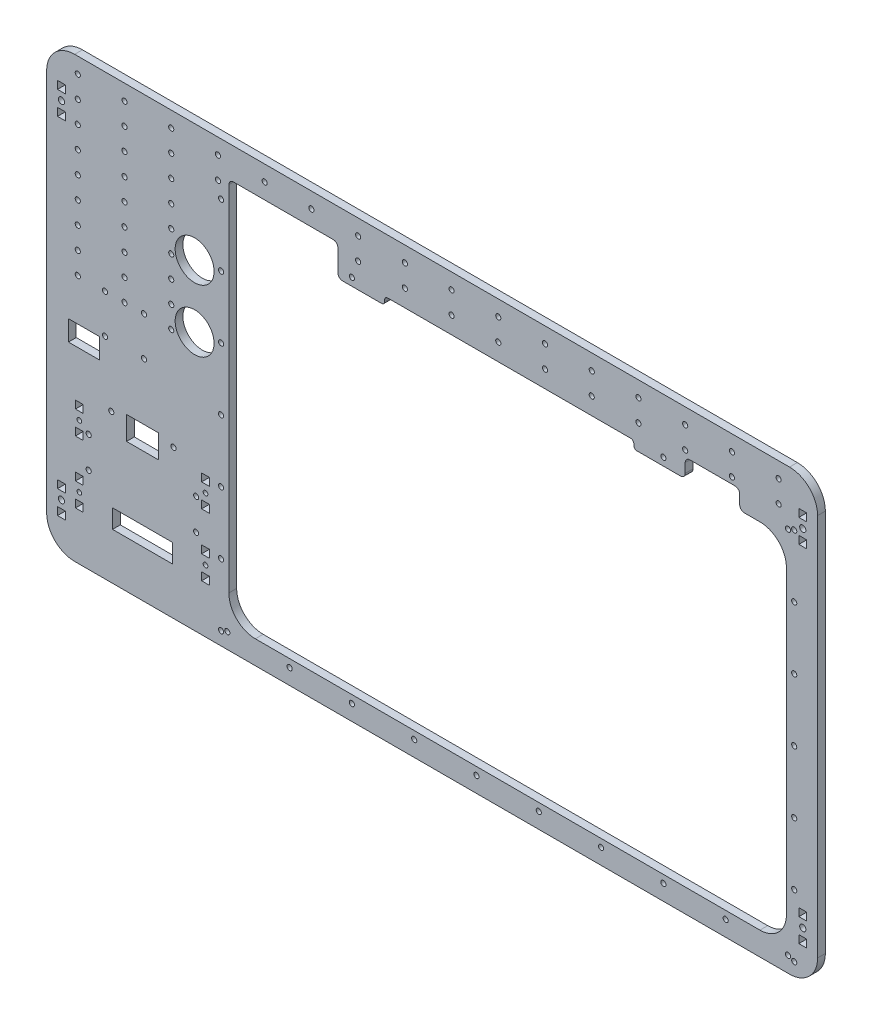
from build123d import *

# Parameters (mm, degrees)
ESQUISSE1_W        = 495
ESQUISSE1_H        = 282
ESQUISSE1_W_2      = 5
ESQUISSE1_H_2      = 5
ESQUISSE1_R        = 2
ESQUISSE1_R_2      = 1.65
ESQUISSE1_R_3      = 1.5
ESQUISSE1_W_3      = 38.4
ESQUISSE1_H_3      = 12
ESQUISSE1_W_4      = 20.4
ESQUISSE1_H_4      = 15
ESQUISSE1_W_5      = 19.8
ESQUISSE1_H_5      = 13
ESQUISSE1_R_4      = 12.5
BOSS_EXTRU_1_DEPTH = 5
CONG_1_R           = 18
CONG_2_R           = 17
CONG_3_R           = 3
CONG_4_R           = 2


with BuildPart() as part:
    # Esquisse1 → Boss.-Extru.1 (new body)
    with BuildSketch(Plane.XY):
        with Locations((-247.5, 141)):
            Rectangle(ESQUISSE1_W, ESQUISSE1_H)
        with Locations((-485.5, 22.5)):
            Rectangle(ESQUISSE1_W_2, ESQUISSE1_H_2, mode=Mode.SUBTRACT)
        with Locations((-485.5, 30)):
            Circle(ESQUISSE1_R, mode=Mode.SUBTRACT)
        with Locations((-474, 32.5)):
            Rectangle(ESQUISSE1_W_2, ESQUISSE1_H_2, mode=Mode.SUBTRACT)
        with Locations((-383, 8.5)):
            Circle(ESQUISSE1_R_2, mode=Mode.SUBTRACT)
        with Locations((-379, 10)):
            Circle(ESQUISSE1_R_2, mode=Mode.SUBTRACT)
        with Locations((-393, 32.5)):
            Rectangle(ESQUISSE1_W_2, ESQUISSE1_H_2, mode=Mode.SUBTRACT)
        with Locations((-485.5, 37.5)):
            Rectangle(ESQUISSE1_W_2, ESQUISSE1_H_2, mode=Mode.SUBTRACT)
        with Locations((-474, 40)):
            Circle(ESQUISSE1_R_3, mode=Mode.SUBTRACT)
        with Locations((-474, 47.5)):
            Rectangle(ESQUISSE1_W_2, ESQUISSE1_H_2, mode=Mode.SUBTRACT)
        with Locations((-433.5, 36)):
            Rectangle(ESQUISSE1_W_3, ESQUISSE1_H_3, mode=Mode.SUBTRACT)
        with Locations((-468, 55.2)):
            Circle(ESQUISSE1_R_2, mode=Mode.SUBTRACT)
        with Locations((-393, 40)):
            Circle(ESQUISSE1_R_3, mode=Mode.SUBTRACT)
        with Locations((-393, 47.5)):
            Rectangle(ESQUISSE1_W_2, ESQUISSE1_H_2, mode=Mode.SUBTRACT)
        with Locations((-383, 48.5)):
            Circle(ESQUISSE1_R_2, mode=Mode.SUBTRACT)
        with Locations((-399, 55.2)):
            Circle(ESQUISSE1_R_2, mode=Mode.SUBTRACT)
        with Locations((-339, 10)):
            Circle(ESQUISSE1_R_2, mode=Mode.SUBTRACT)
        with Locations((-299, 10)):
            Circle(ESQUISSE1_R_2, mode=Mode.SUBTRACT)
        with Locations((-259, 10)):
            Circle(ESQUISSE1_R_2, mode=Mode.SUBTRACT)
        with Locations((-474, 72.5)):
            Rectangle(ESQUISSE1_W_2, ESQUISSE1_H_2, mode=Mode.SUBTRACT)
        with Locations((-468, 75.2)):
            Circle(ESQUISSE1_R_2, mode=Mode.SUBTRACT)
        with Locations((-474, 80)):
            Circle(ESQUISSE1_R_3, mode=Mode.SUBTRACT)
        with Locations((-474, 87.5)):
            Rectangle(ESQUISSE1_W_2, ESQUISSE1_H_2, mode=Mode.SUBTRACT)
        with Locations((-453.5, 95.2)):
            Circle(ESQUISSE1_R_2, mode=Mode.SUBTRACT)
        with Locations((-433.5, 90.9)):
            Rectangle(ESQUISSE1_W_4, ESQUISSE1_H_4, mode=Mode.SUBTRACT)
        with Locations((-393, 72.5)):
            Rectangle(ESQUISSE1_W_2, ESQUISSE1_H_2, mode=Mode.SUBTRACT)
        with Locations((-399, 75.2)):
            Circle(ESQUISSE1_R_2, mode=Mode.SUBTRACT)
        with Locations((-393, 80)):
            Circle(ESQUISSE1_R_3, mode=Mode.SUBTRACT)
        with Locations((-393, 87.5)):
            Rectangle(ESQUISSE1_W_2, ESQUISSE1_H_2, mode=Mode.SUBTRACT)
        with Locations((-413.5, 95.2)):
            Circle(ESQUISSE1_R_2, mode=Mode.SUBTRACT)
        with Locations((-383, 88.5)):
            Circle(ESQUISSE1_R_2, mode=Mode.SUBTRACT)
        with Locations((-471.1, 126.5)):
            Rectangle(ESQUISSE1_W_5, ESQUISSE1_H_5, mode=Mode.SUBTRACT)
        with Locations((-457.5, 135)):
            Circle(ESQUISSE1_R_2, mode=Mode.SUBTRACT)
        with Locations((-432.5, 135)):
            Circle(ESQUISSE1_R_2, mode=Mode.SUBTRACT)
        with Locations((-383, 128.5)):
            Circle(ESQUISSE1_R_2, mode=Mode.SUBTRACT)
        with Locations((-219, 10)):
            Circle(ESQUISSE1_R_2, mode=Mode.SUBTRACT)
        with Locations((-179, 10)):
            Circle(ESQUISSE1_R_2, mode=Mode.SUBTRACT)
        with Locations((-139, 10)):
            Circle(ESQUISSE1_R_2, mode=Mode.SUBTRACT)
        with Locations((-99, 10)):
            Circle(ESQUISSE1_R_2, mode=Mode.SUBTRACT)
        with Locations((-59, 10)):
            Circle(ESQUISSE1_R_2, mode=Mode.SUBTRACT)
        with Locations((-15, 8.5)):
            Circle(ESQUISSE1_R_2, mode=Mode.SUBTRACT)
        with Locations((-19, 10)):
            Circle(ESQUISSE1_R_2, mode=Mode.SUBTRACT)
        with Locations((-9.5, 22.5)):
            Rectangle(ESQUISSE1_W_2, ESQUISSE1_H_2, mode=Mode.SUBTRACT)
        with Locations((-9.5, 30)):
            Circle(ESQUISSE1_R, mode=Mode.SUBTRACT)
        with Locations((-9.5, 37.5)):
            Rectangle(ESQUISSE1_W_2, ESQUISSE1_H_2, mode=Mode.SUBTRACT)
        with Locations((-15, 48.5)):
            Circle(ESQUISSE1_R_2, mode=Mode.SUBTRACT)
        Polygon((-378, 15), (-378, 242), (-378, 262), (-308, 262), (-308, 242), (-278, 242), (-278, 247), (-118, 247), (-118, 242), (-85, 242), (-85, 254), (-50, 254), (-50, 242), (-20, 242), (-20, 15), align=None, mode=Mode.SUBTRACT)
        with Locations((-15, 88.5)):
            Circle(ESQUISSE1_R_2, mode=Mode.SUBTRACT)
        with Locations((-15, 128.5)):
            Circle(ESQUISSE1_R_2, mode=Mode.SUBTRACT)
        with Locations((-475, 160)):
            Circle(ESQUISSE1_R_2, mode=Mode.SUBTRACT)
        with Locations((-475, 174)):
            Circle(ESQUISSE1_R_2, mode=Mode.SUBTRACT)
        with Locations((-457.5, 160)):
            Circle(ESQUISSE1_R_2, mode=Mode.SUBTRACT)
        with Locations((-445, 160)):
            Circle(ESQUISSE1_R_2, mode=Mode.SUBTRACT)
        with Locations((-445, 174)):
            Circle(ESQUISSE1_R_2, mode=Mode.SUBTRACT)
        with Locations((-432.5, 160)):
            Circle(ESQUISSE1_R_2, mode=Mode.SUBTRACT)
        with Locations((-415, 160)):
            Circle(ESQUISSE1_R_2, mode=Mode.SUBTRACT)
        with Locations((-415, 174)):
            Circle(ESQUISSE1_R_2, mode=Mode.SUBTRACT)
        with Locations((-400, 166)):
            Circle(ESQUISSE1_R_4, mode=Mode.SUBTRACT)
        with Locations((-383, 168.5)):
            Circle(ESQUISSE1_R_2, mode=Mode.SUBTRACT)
        with Locations((-475, 188)):
            Circle(ESQUISSE1_R_2, mode=Mode.SUBTRACT)
        with Locations((-445, 188)):
            Circle(ESQUISSE1_R_2, mode=Mode.SUBTRACT)
        with Locations((-475, 202)):
            Circle(ESQUISSE1_R_2, mode=Mode.SUBTRACT)
        with Locations((-445, 202)):
            Circle(ESQUISSE1_R_2, mode=Mode.SUBTRACT)
        with Locations((-415, 188)):
            Circle(ESQUISSE1_R_2, mode=Mode.SUBTRACT)
        with Locations((-415, 202)):
            Circle(ESQUISSE1_R_2, mode=Mode.SUBTRACT)
        with Locations((-400, 206)):
            Circle(ESQUISSE1_R_4, mode=Mode.SUBTRACT)
        with Locations((-383, 208.5)):
            Circle(ESQUISSE1_R_2, mode=Mode.SUBTRACT)
        with Locations((-475, 216)):
            Circle(ESQUISSE1_R_2, mode=Mode.SUBTRACT)
        with Locations((-445, 216)):
            Circle(ESQUISSE1_R_2, mode=Mode.SUBTRACT)
        with Locations((-475, 230)):
            Circle(ESQUISSE1_R_2, mode=Mode.SUBTRACT)
        with Locations((-485.5, 244.5)):
            Rectangle(ESQUISSE1_W_2, ESQUISSE1_H_2, mode=Mode.SUBTRACT)
        with Locations((-475, 244)):
            Circle(ESQUISSE1_R_2, mode=Mode.SUBTRACT)
        with Locations((-445, 230)):
            Circle(ESQUISSE1_R_2, mode=Mode.SUBTRACT)
        with Locations((-445, 244)):
            Circle(ESQUISSE1_R_2, mode=Mode.SUBTRACT)
        with Locations((-415, 216)):
            Circle(ESQUISSE1_R_2, mode=Mode.SUBTRACT)
        with Locations((-415, 230)):
            Circle(ESQUISSE1_R_2, mode=Mode.SUBTRACT)
        with Locations((-415, 244)):
            Circle(ESQUISSE1_R_2, mode=Mode.SUBTRACT)
        with Locations((-485.5, 252)):
            Circle(ESQUISSE1_R, mode=Mode.SUBTRACT)
        with Locations((-485.5, 259.5)):
            Rectangle(ESQUISSE1_W_2, ESQUISSE1_H_2, mode=Mode.SUBTRACT)
        with Locations((-475, 258)):
            Circle(ESQUISSE1_R_2, mode=Mode.SUBTRACT)
        with Locations((-445, 258)):
            Circle(ESQUISSE1_R_2, mode=Mode.SUBTRACT)
        with Locations((-475, 272)):
            Circle(ESQUISSE1_R_2, mode=Mode.SUBTRACT)
        with Locations((-445, 272)):
            Circle(ESQUISSE1_R_2, mode=Mode.SUBTRACT)
        with Locations((-415, 258)):
            Circle(ESQUISSE1_R_2, mode=Mode.SUBTRACT)
        with Locations((-383, 248.5)):
            Circle(ESQUISSE1_R_2, mode=Mode.SUBTRACT)
        with Locations((-385, 258)):
            Circle(ESQUISSE1_R_2, mode=Mode.SUBTRACT)
        with Locations((-415, 272)):
            Circle(ESQUISSE1_R_2, mode=Mode.SUBTRACT)
        with Locations((-385, 272)):
            Circle(ESQUISSE1_R_2, mode=Mode.SUBTRACT)
        with Locations((-355, 272)):
            Circle(ESQUISSE1_R_2, mode=Mode.SUBTRACT)
        with Locations((-325, 272)):
            Circle(ESQUISSE1_R_2, mode=Mode.SUBTRACT)
        with Locations((-299, 247)):
            Circle(ESQUISSE1_R_2, mode=Mode.SUBTRACT)
        with Locations((-295, 258)):
            Circle(ESQUISSE1_R_2, mode=Mode.SUBTRACT)
        with Locations((-265, 258)):
            Circle(ESQUISSE1_R_2, mode=Mode.SUBTRACT)
        with Locations((-295, 272)):
            Circle(ESQUISSE1_R_2, mode=Mode.SUBTRACT)
        with Locations((-265, 272)):
            Circle(ESQUISSE1_R_2, mode=Mode.SUBTRACT)
        with Locations((-15, 168.5)):
            Circle(ESQUISSE1_R_2, mode=Mode.SUBTRACT)
        with Locations((-15, 208.5)):
            Circle(ESQUISSE1_R_2, mode=Mode.SUBTRACT)
        with Locations((-235, 258)):
            Circle(ESQUISSE1_R_2, mode=Mode.SUBTRACT)
        with Locations((-205, 258)):
            Circle(ESQUISSE1_R_2, mode=Mode.SUBTRACT)
        with Locations((-235, 272)):
            Circle(ESQUISSE1_R_2, mode=Mode.SUBTRACT)
        with Locations((-205, 272)):
            Circle(ESQUISSE1_R_2, mode=Mode.SUBTRACT)
        with Locations((-175, 258)):
            Circle(ESQUISSE1_R_2, mode=Mode.SUBTRACT)
        with Locations((-145, 258)):
            Circle(ESQUISSE1_R_2, mode=Mode.SUBTRACT)
        with Locations((-175, 272)):
            Circle(ESQUISSE1_R_2, mode=Mode.SUBTRACT)
        with Locations((-145, 272)):
            Circle(ESQUISSE1_R_2, mode=Mode.SUBTRACT)
        with Locations((-9.5, 244.5)):
            Rectangle(ESQUISSE1_W_2, ESQUISSE1_H_2, mode=Mode.SUBTRACT)
        with Locations((-99, 247)):
            Circle(ESQUISSE1_R_2, mode=Mode.SUBTRACT)
        with Locations((-115, 258)):
            Circle(ESQUISSE1_R_2, mode=Mode.SUBTRACT)
        with Locations((-85, 258)):
            Circle(ESQUISSE1_R_2, mode=Mode.SUBTRACT)
        with Locations((-115, 272)):
            Circle(ESQUISSE1_R_2, mode=Mode.SUBTRACT)
        with Locations((-85, 272)):
            Circle(ESQUISSE1_R_2, mode=Mode.SUBTRACT)
        with Locations((-55, 258)):
            Circle(ESQUISSE1_R_2, mode=Mode.SUBTRACT)
        with Locations((-19, 247)):
            Circle(ESQUISSE1_R_2, mode=Mode.SUBTRACT)
        with Locations((-15, 248.5)):
            Circle(ESQUISSE1_R_2, mode=Mode.SUBTRACT)
        with Locations((-9.5, 252)):
            Circle(ESQUISSE1_R, mode=Mode.SUBTRACT)
        with Locations((-25, 258)):
            Circle(ESQUISSE1_R_2, mode=Mode.SUBTRACT)
        with Locations((-9.5, 259.5)):
            Rectangle(ESQUISSE1_W_2, ESQUISSE1_H_2, mode=Mode.SUBTRACT)
        with Locations((-55, 272)):
            Circle(ESQUISSE1_R_2, mode=Mode.SUBTRACT)
        with Locations((-25, 272)):
            Circle(ESQUISSE1_R_2, mode=Mode.SUBTRACT)
    extrude(amount=BOSS_EXTRU_1_DEPTH)

    # Congé1
    cong_1_edges = [part.edges().sort_by_distance(p)[0] for p in [
        (0, 0, 2.5),
        (-495, 0, 2.5),
        (-495, 282, 2.5),
        (0, 282, 2.5),
    ]]
    fillet(cong_1_edges, radius=CONG_1_R)

    # Congé2
    cong_2_edges = [part.edges().sort_by_distance(p)[0] for p in [
        (-378, 15, 2.5),
        (-20, 15, 2.5),
        (-20, 242, 2.5),
    ]]
    fillet(cong_2_edges, radius=CONG_2_R)

    # Congé3
    cong_3_edges = [part.edges().sort_by_distance(p)[0] for p in [
        (-50, 254, 2.5),
        (-85, 254, 2.5),
        (-85, 242, 2.5),
        (-308, 242, 2.5),
        (-308, 262, 2.5),
        (-378, 262, 2.5),
        (-50, 242, 2.5),
    ]]
    fillet(cong_3_edges, radius=CONG_3_R)

    # Congé4
    cong_4_edges = [part.edges().sort_by_distance(p)[0] for p in [
        (-118, 242, 2.5),
        (-118, 247, 2.5),
        (-278, 247, 2.5),
        (-278, 242, 2.5),
    ]]
    fillet(cong_4_edges, radius=CONG_4_R)


solid = part.part
